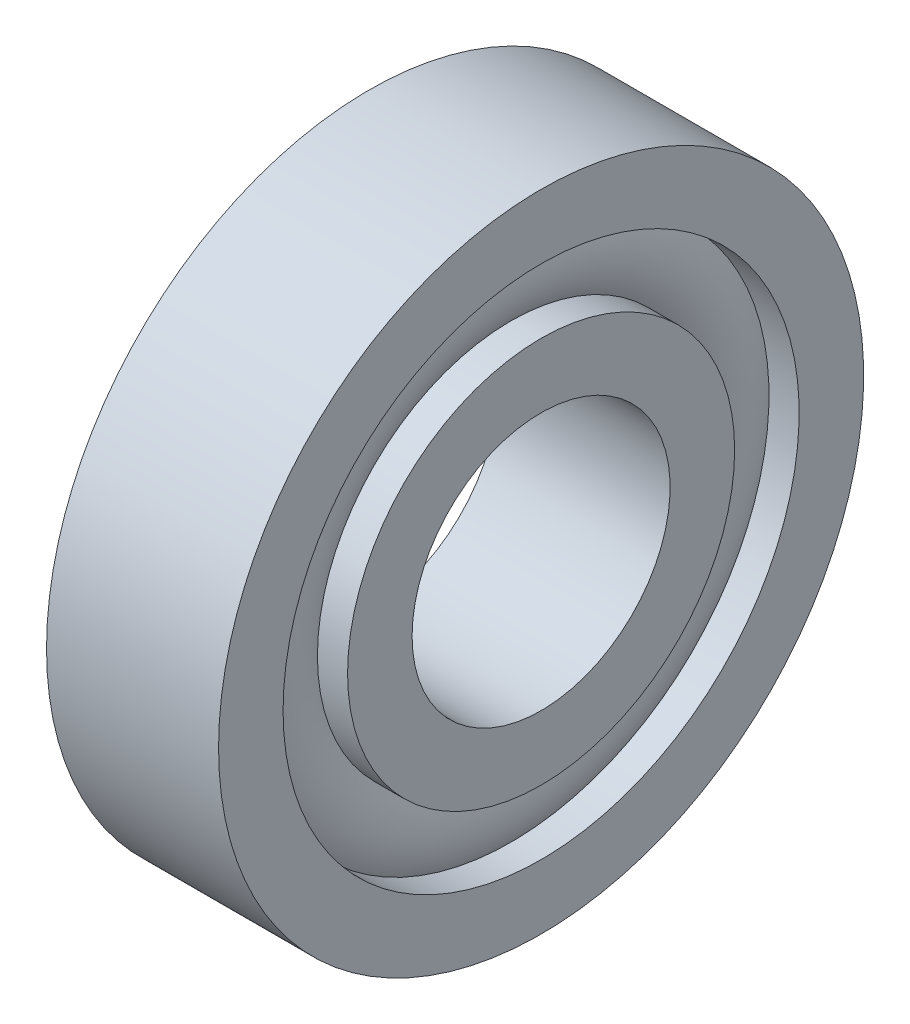
from build123d import *


with BuildPart() as part:
    # Esquisse1 → Révolution1 (revolve)
    with BuildSketch(Plane.XY, mode=Mode.PRIVATE) as r_volution1_sk:
        with BuildLine():
            Line((-4, 6), (4, 6))
            Line((4, 6), (4, 9))
            Line((4, 9), (2.598076211, 9))
            ThreePointArc((2.598076211, 9), (3, 10.5), (2.598076211, 12))
            Line((2.598076211, 12), (4, 12))
            Line((4, 12), (4, 15))
            Line((4, 15), (-4, 15))
            Line((-4, 15), (-4, 12))
            Line((-4, 12), (-2.598076211, 12))
            ThreePointArc((-2.598076211, 12), (-3, 10.5), (-2.598076211, 9))
            Line((-2.598076211, 9), (-4, 9))
            Line((-4, 9), (-4, 6))
        make_face()
    revolve(r_volution1_sk.sketch.rotate(Axis((-4, 0, 0), (1, 0, 0)), 90), axis=Axis((-4, 0, 0), (1, 0, 0)))


solid = part.part
